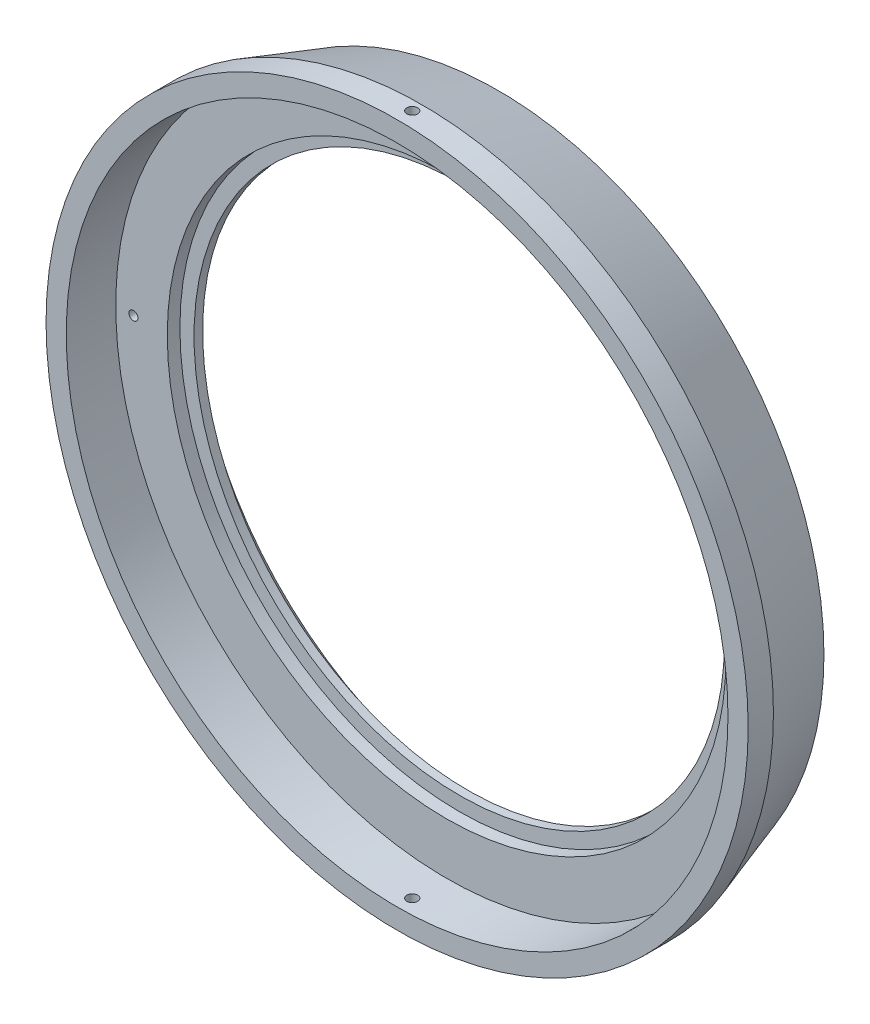
from build123d import *

# Parameters (mm, degrees)
SKETCH1_R                     = 88.265
BOSS_EXTRUDE1_DEPTH           = 25.4
SKETCH2_R                     = 83.185
CUT_EXTRUDE1_DEPTH            = 9.144
SKETCH3_R                     = 76.2
CUT_EXTRUDE2_DEPTH            = 3.302
SKETCH4_R                     = 70.231
CUT_EXTRUDE3_DEPTH            = 3.175
SKETCH6_R                     = 66.675
CUT_EXTRUDE5_DEPTH            = 126.799189548
SKETCH7_R                     = 83.185
CUT_EXTRUDE6_DEPTH            = 3.302
CHAMFER2_SIZE                 = 6.35
CHAMFER2_SIZE2                = 19.05
CHAMFER1_SIZE                 = 7.62
CHAMFER1_SIZE2                = 10.16
CUT_EXTRUDE4_DEPTH            = 128.383595686
CUT_EXTRUDE4_DEPTH_BACK       = 128.383595686
SKETCH5_R                     = 1.35255
TAP_DRILL_FOR_4_40_TAP1_D     = 2.2606
TAP_DRILL_FOR_4_40_TAP1_DEPTH = 6.35
TAP_DRILL_FOR_4_40_TAP1_TIP   = 0.679152758


with BuildPart() as part:
    # Sketch1 → Boss-Extrude1 (new body)
    with BuildSketch(Plane.XY):
        Circle(SKETCH1_R)
    extrude(amount=BOSS_EXTRUDE1_DEPTH)

    # Sketch2 → Cut-Extrude1 (cut)
    with BuildSketch(Plane.XY.offset(25.4)):
        Circle(SKETCH2_R)
    extrude(amount=-CUT_EXTRUDE1_DEPTH, mode=Mode.SUBTRACT)

    # Sketch3 → Cut-Extrude2 (cut)
    with BuildSketch(Plane.XY.offset(16.256)):
        Circle(SKETCH3_R)
    extrude(amount=-CUT_EXTRUDE2_DEPTH, mode=Mode.SUBTRACT)

    # Sketch4 → Cut-Extrude3 (cut)
    with BuildSketch(Plane.XY.offset(12.954)):
        Circle(SKETCH4_R)
    extrude(amount=-CUT_EXTRUDE3_DEPTH, mode=Mode.SUBTRACT)

    # Sketch6 → Cut-Extrude5 (cut, through all)
    with BuildSketch(Plane.XY.offset(9.779)):
        Circle(SKETCH6_R)
    extrude(amount=-CUT_EXTRUDE5_DEPTH, mode=Mode.SUBTRACT)

    # Sketch7 → Cut-Extrude6 (cut)
    with BuildSketch(Plane.XY.offset(16.256)):
        Circle(SKETCH7_R)
    extrude(amount=-CUT_EXTRUDE6_DEPTH, mode=Mode.SUBTRACT)

    # Chamfer2
    chamfer2_edges = [part.edges().sort_by_distance(p)[0] for p in [
        (-88.265, 0, 0),
    ]]
    chamfer2_side = [part.faces().sort_by_distance(p)[0] for p in [
        (-85.768488798, 0, 0),
    ]]
    chamfer(chamfer2_edges, length=CHAMFER2_SIZE, length2=CHAMFER2_SIZE2, reference=chamfer2_side[0])

    # Chamfer1
    chamfer1_edges = [part.edges().sort_by_distance(p)[0] for p in [
        (-66.675, 0, 0),
    ]]
    chamfer1_side = [part.faces().sort_by_distance(p)[0] for p in [
        (-66.675, 0, 4.8895),
    ]]
    chamfer(chamfer1_edges, length=CHAMFER1_SIZE, length2=CHAMFER1_SIZE2, reference=chamfer1_side[0])

    # Sketch5 → Cut-Extrude4 (cut, two sides: drawn at the far end of the back side and taken through both)
    with BuildSketch(Plane(origin=(0, 0, 0), x_dir=(1, 0, 0), z_dir=(0, 1, 0)).offset(-CUT_EXTRUDE4_DEPTH_BACK)):
        with Locations(Location((0, -21.59, 0), (0, 0, 270))):
            Circle(SKETCH5_R)
    extrude(amount=CUT_EXTRUDE4_DEPTH + CUT_EXTRUDE4_DEPTH_BACK, mode=Mode.SUBTRACT)

    # Tap Drill for #4-40 Tap1
    with Locations(Plane.XY.offset(12.954)):
        with Locations((-78.74, 0), (78.74, 0)):
            Hole(TAP_DRILL_FOR_4_40_TAP1_D / 2, depth=TAP_DRILL_FOR_4_40_TAP1_DEPTH)
            with Locations((0, 0, -(TAP_DRILL_FOR_4_40_TAP1_DEPTH + TAP_DRILL_FOR_4_40_TAP1_TIP / 2))):  # 118° drill point
                Cone(0, TAP_DRILL_FOR_4_40_TAP1_D / 2, TAP_DRILL_FOR_4_40_TAP1_TIP, mode=Mode.SUBTRACT)


solid = part.part
